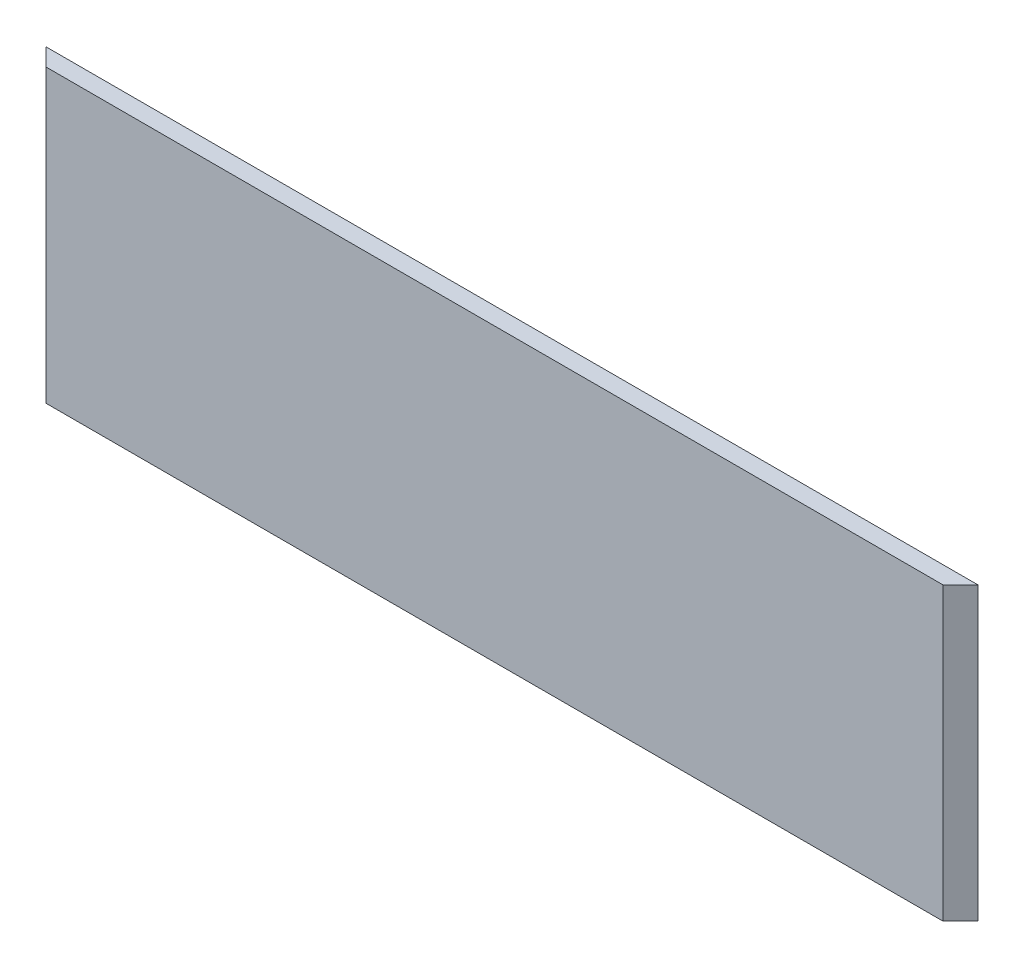
from build123d import *

# Parameters (mm, degrees)
SKETCH1_W           = 160
SKETCH1_H           = 3
BOSS_EXTRUDE1_DEPTH = 50
CUT_EXTRUDE1_DEPTH  = 55


with BuildPart() as part:
    # Sketch1 → Boss-Extrude1 (new body)
    with BuildSketch(Plane(origin=(0, 0, 0), x_dir=(1, 0, 0), z_dir=(0, 1, 0))):
        Rectangle(SKETCH1_W, SKETCH1_H)
    extrude(amount=BOSS_EXTRUDE1_DEPTH)

    # Sketch3 → Cut-Extrude1 (cut)
    with BuildSketch(Plane(origin=(0, 50, 0), x_dir=(1, 0, 0), z_dir=(0, 1, 0))):
        Polygon((-80, -1.5), (-80, 1.5), (-77, -1.5), align=None)
        Polygon((80, -1.5), (80, 1.5), (77, -1.5), align=None)
    extrude(amount=-CUT_EXTRUDE1_DEPTH, mode=Mode.SUBTRACT)


solid = part.part
